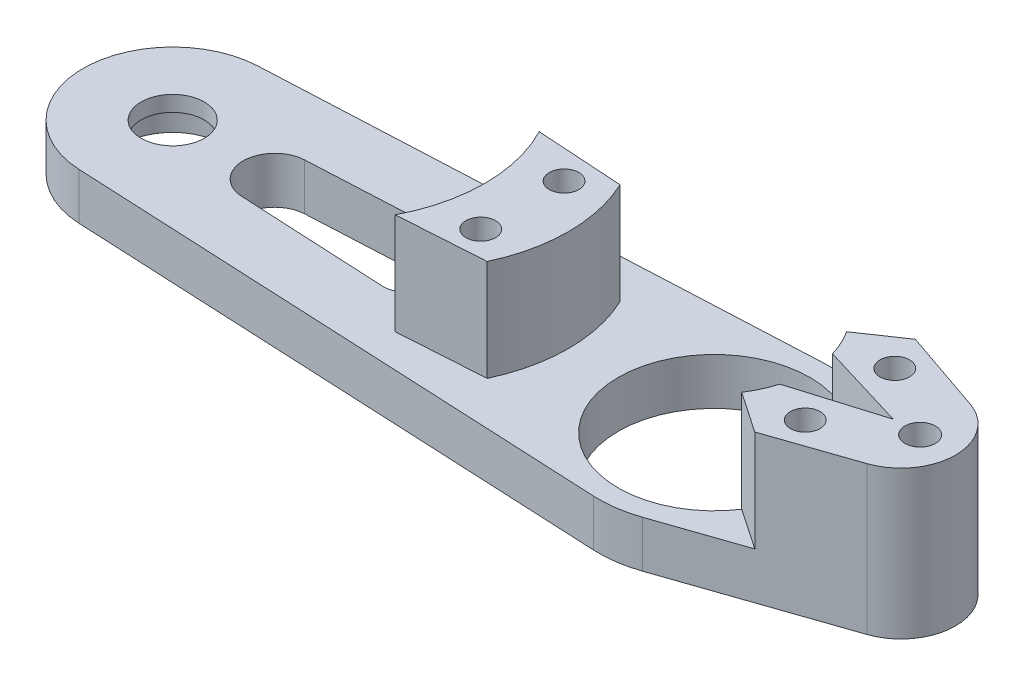
from build123d import *

# Parameters (mm, degrees)
SKETCH1_R           = 1.9
SKETCH1_R_2         = 4.05
SKETCH1_R_3         = 12.3
SKETCH1_R_4         = 1.95
BOSS_EXTRUDE1_DEPTH = 6
SKETCH2_R           = 6.55
CUT_EXTRUDE1_DEPTH  = 4
SKETCH3_R           = 1.9
BOSS_EXTRUDE3_DEPTH = 13
SKETCH4_R           = 1.9
SKETCH4_R_2         = 1.95
BOSS_EXTRUDE4_DEPTH = 13


with BuildPart() as part:
    # Sketch1 → Boss-Extrude1 (new body)
    with BuildSketch(Plane(origin=(0, 0, 0), x_dir=(1, 0, 0), z_dir=(0, 1, 0))):
        with BuildLine():
            Line((68.797266187, 14.783306977), (-0.546043165, 11.48702907))
            ThreePointArc((-0.546043165, 11.48702907), (-11.5, 0), (-0.546043165, -11.48702907))
            Line((-0.546043165, -11.48702907), (68.797266187, -14.783306977))
            ThreePointArc((68.797266187, -14.783306977), (71.590968354, -14.651547746), (74.31, -13.996567436))
            Line((74.31, -13.996567436), (95.775, -6.619998112))
            ThreePointArc((95.775, -6.619998112), (100.5, 0), (95.775, 6.619998112))
            Line((95.775, 6.619998112), (74.31, 13.996567436))
            ThreePointArc((74.31, 13.996567436), (71.590968354, 14.651547746), (68.797266187, 14.783306977))
        make_face()
        with Locations(Location((44.9, -5.35, 0), (0, 0, 270))):
            Circle(SKETCH1_R, mode=Mode.SUBTRACT)
        with Locations(Location((0, 0, 0), (0, 0, 270))):
            Circle(SKETCH1_R_2, mode=Mode.SUBTRACT)
        with BuildLine():
            ThreePointArc((12.898162181, -4.044967428), (9.05, 0), (12.898162181, 4.044967428))
            Line((12.898162181, 4.044967428), (31.975408753, 4.996893474))
            ThreePointArc((31.975408753, 4.996893474), (33.823154358, 4.311281054), (34.6, 2.5))
            Line((34.6, 2.5), (34.6, -2.5))
            ThreePointArc((34.6, -2.5), (33.823154358, -4.311281054), (31.975408753, -4.996893474))
            Line((31.975408753, -4.996893474), (12.898162181, -4.044967428))
        make_face(mode=Mode.SUBTRACT)
        with Locations(Location((44.9, 5.35, 0), (0, 0, 270))):
            Circle(SKETCH1_R, mode=Mode.SUBTRACT)
        with Locations(Location((69.5, 0, 0), (0, 0, 270))):
            Circle(SKETCH1_R_3, mode=Mode.SUBTRACT)
        with Locations(Location((86.96, 5.75, 0), (0, 0, 270))):
            Circle(SKETCH1_R, mode=Mode.SUBTRACT)
        with Locations(Location((95.96, 0, 0), (0, 0, 270))):
            Circle(SKETCH1_R_4, mode=Mode.SUBTRACT)
        with Locations(Location((86.96, -5.75, 0), (0, 0, 270))):
            Circle(SKETCH1_R, mode=Mode.SUBTRACT)
    extrude(amount=BOSS_EXTRUDE1_DEPTH)

    # Sketch2 → Cut-Extrude1 (cut)
    with BuildSketch(Plane(origin=(0, 0, 0), x_dir=(1, 0, 0), z_dir=(0, 1, 0))):
        with Locations(Location((0, 0, 0), (0, 0, 270))):
            Circle(SKETCH2_R)
    extrude(amount=CUT_EXTRUDE1_DEPTH, mode=Mode.SUBTRACT)

    # Sketch3 → Boss-Extrude3 (add)
    with BuildSketch(Plane(origin=(0, 6, 0), x_dir=(1, 0, 0), z_dir=(0, 1, 0))):
        with BuildLine():
            Line((37.810248758, 9.243466249), (48.9, 8.53))
            ThreePointArc((48.9, 8.53), (50.810248758, 0), (48.9, -8.53))
            Line((48.9, -8.53), (37.810248758, -9.243466249))
            ThreePointArc((37.810248758, -9.243466249), (40.074456368, 0), (37.810248758, 9.243466249))
        make_face()
        with Locations(Location((44.9, -5.35, 0), (0, 0, 270))):
            Circle(SKETCH3_R, mode=Mode.SUBTRACT)
        with Locations(Location((44.9, 5.35, 0), (0, 0, 270))):
            Circle(SKETCH3_R, mode=Mode.SUBTRACT)
    extrude(amount=BOSS_EXTRUDE3_DEPTH)

    # Sketch4 → Boss-Extrude4 (add)
    with BuildSketch(Plane(origin=(0, 6, 0), x_dir=(1, 0, 0), z_dir=(0, 1, 0))):
        with BuildLine():
            Line((85.0425, 10.308282774), (79.790912588, 6.736996223))
            ThreePointArc((79.790912588, 6.736996223), (80.683848774, 5.119719388), (81.32449086, 3.386947876))
            Line((81.32449086, 3.386947876), (92.5, 0))
            Line((92.5, 0), (81.32449086, -3.386947876))
            ThreePointArc((81.32449086, -3.386947876), (80.683848774, -5.119719388), (79.790912588, -6.736996223))
            Line((79.790912588, -6.736996223), (85.0425, -10.308282774))
            Line((85.0425, -10.308282774), (95.775, -6.619998112))
            ThreePointArc((95.775, -6.619998112), (100.5, 0), (95.775, 6.619998112))
            Line((95.775, 6.619998112), (85.0425, 10.308282774))
        make_face()
        with Locations(Location((86.96, 5.75, 0), (0, 0, 270))):
            Circle(SKETCH4_R, mode=Mode.SUBTRACT)
        with Locations(Location((86.96, -5.75, 0), (0, 0, 270))):
            Circle(SKETCH4_R, mode=Mode.SUBTRACT)
        with Locations(Location((95.96, 0, 0), (0, 0, 270))):
            Circle(SKETCH4_R_2, mode=Mode.SUBTRACT)
    extrude(amount=BOSS_EXTRUDE4_DEPTH)


solid = part.part
